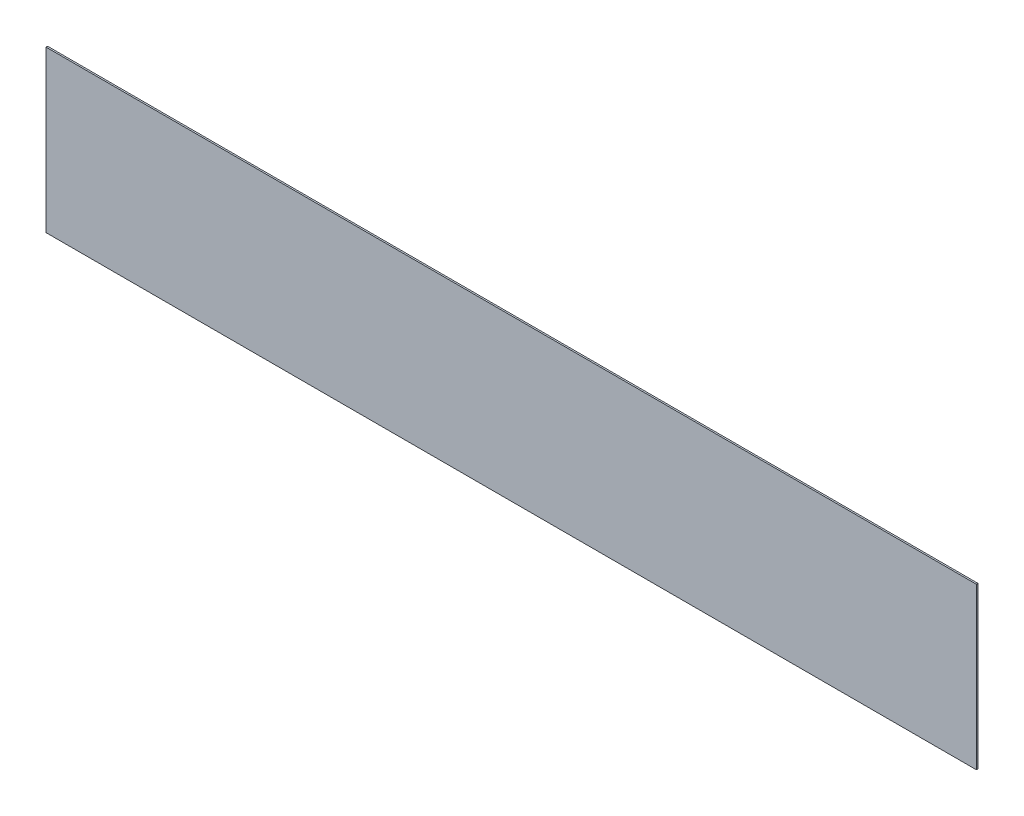
from build123d import *

# Parameters (mm, degrees)
CEK_ICECEK_KUTU_ARKA_1_0_1_START = -699
SKETCH1_W                        = 590.6
SKETCH1_H                        = 102
CEK_ICECEK_KUTU_ARKA_1_0_1_DEPTH = 1


with BuildPart() as part:
    # Sketch1 → CEK_icecek_kutu_arka_1.0_1 (new body)
    with BuildSketch(Plane.XY.offset(CEK_ICECEK_KUTU_ARKA_1_0_1_START)):
        with Locations((309, 55)):
            Rectangle(SKETCH1_W, SKETCH1_H)
    extrude(amount=-CEK_ICECEK_KUTU_ARKA_1_0_1_DEPTH)


solid = part.part
